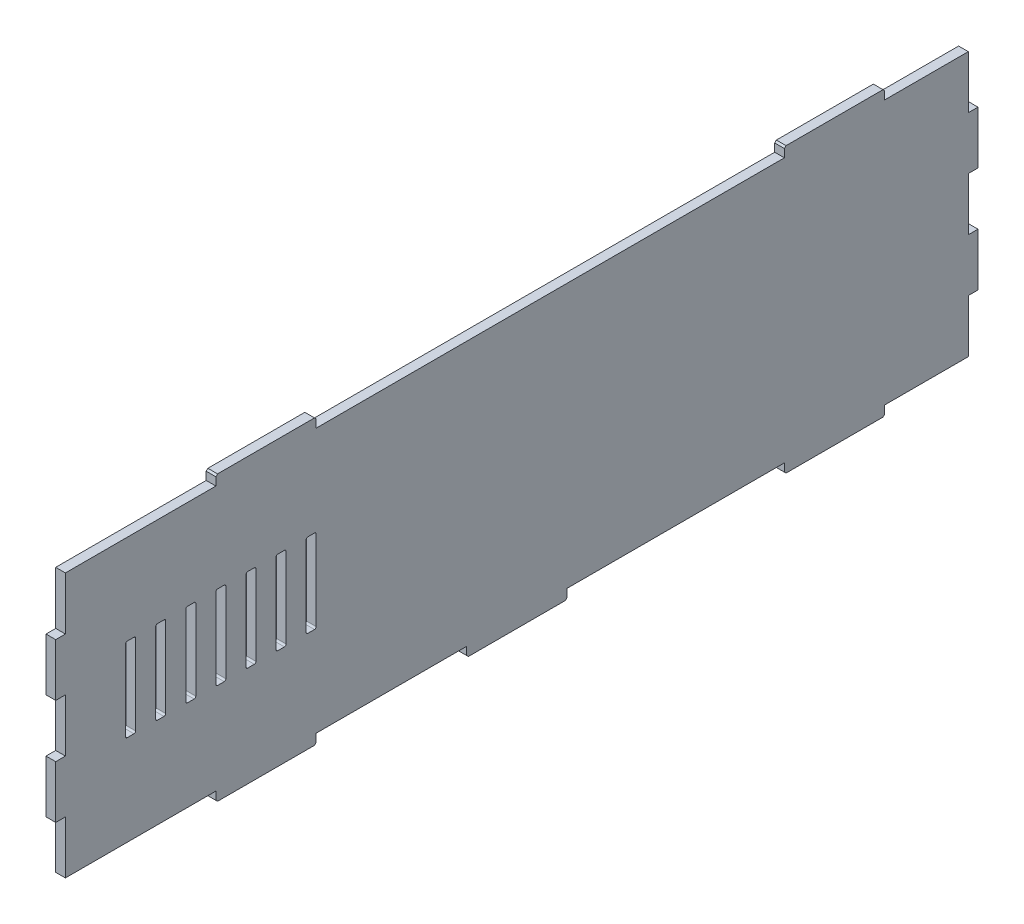
from build123d import *

# Parameters (mm, degrees)
BOSS_EXTRUDE1_DEPTH = 2.9


with BuildPart() as part:
    # Sketch1 → Boss-Extrude1 (new body)
    with BuildSketch(Plane(origin=(-118.9, 0, 0), x_dir=(0, 0, -1), z_dir=(1, 0, 0))):
        Polygon((135, 2.9), (110, 2.9), (110, 0.5), (109.5, 0), (80.5, 0), (80, 0.5), (80, 2.9), (15, 2.9), (15, 0.5), (14.5, 0), (-14.5, 0), (-15, 0.5), (-15, 2.9), (-60, 2.9), (-60, 0.5), (-60.5, 0), (-89.5, 0), (-90, 0.5), (-90, 2.9), (-135, 2.9), (-135, 18.725), (-137.9, 18.725), (-137.9, 34.475), (-135, 34.475), (-135, 50.325), (-137.9, 50.325), (-137.9, 66.075), (-135, 66.075), (-135, 81.9), (-90, 81.9), (-90, 84.3), (-89.5, 84.8), (-60.5, 84.8), (-60, 84.3), (-60, 81.9), (80, 81.9), (80, 84.3), (80.5, 84.8), (109.5, 84.8), (110, 84.3), (110, 81.9), (135, 81.9), (135, 66.075), (137.9, 66.075), (137.9, 50.325), (135, 50.325), (135, 34.475), (137.9, 34.475), (137.9, 18.725), (135, 18.725), align=None)
        with BuildLine():
            Line((-114.5, 30), (-116.5, 30))
            ThreePointArc((-116.5, 30), (-116.853553391, 30.146446609), (-117, 30.5))
            Line((-117, 30.5), (-117, 54.5))
            ThreePointArc((-117, 54.5), (-116.853553391, 54.853553391), (-116.5, 55))
            Line((-116.5, 55), (-114.5, 55))
            ThreePointArc((-114.5, 55), (-114.146446609, 54.853553391), (-114, 54.5))
            Line((-114, 54.5), (-114, 30.5))
            ThreePointArc((-114, 30.5), (-114.146446609, 30.146446609), (-114.5, 30))
        make_face(mode=Mode.SUBTRACT)
        with BuildLine():
            Line((-105.5, 30), (-107.5, 30))
            ThreePointArc((-107.5, 30), (-107.853553391, 30.146446609), (-108, 30.5))
            Line((-108, 30.5), (-108, 54.5))
            ThreePointArc((-108, 54.5), (-107.853553391, 54.853553391), (-107.5, 55))
            Line((-107.5, 55), (-105.5, 55))
            ThreePointArc((-105.5, 55), (-105.146446609, 54.853553391), (-105, 54.5))
            Line((-105, 54.5), (-105, 30.5))
            ThreePointArc((-105, 30.5), (-105.146446609, 30.146446609), (-105.5, 30))
        make_face(mode=Mode.SUBTRACT)
        with BuildLine():
            Line((-96.5, 30), (-98.5, 30))
            ThreePointArc((-98.5, 30), (-98.853553391, 30.146446609), (-99, 30.5))
            Line((-99, 30.5), (-99, 54.5))
            ThreePointArc((-99, 54.5), (-98.853553391, 54.853553391), (-98.5, 55))
            Line((-98.5, 55), (-96.5, 55))
            ThreePointArc((-96.5, 55), (-96.146446609, 54.853553391), (-96, 54.5))
            Line((-96, 54.5), (-96, 30.5))
            ThreePointArc((-96, 30.5), (-96.146446609, 30.146446609), (-96.5, 30))
        make_face(mode=Mode.SUBTRACT)
        with BuildLine():
            Line((-87.5, 30), (-89.5, 30))
            ThreePointArc((-89.5, 30), (-89.853553391, 30.146446609), (-90, 30.5))
            Line((-90, 30.5), (-90, 54.5))
            ThreePointArc((-90, 54.5), (-89.853553391, 54.853553391), (-89.5, 55))
            Line((-89.5, 55), (-87.5, 55))
            ThreePointArc((-87.5, 55), (-87.146446609, 54.853553391), (-87, 54.5))
            Line((-87, 54.5), (-87, 30.5))
            ThreePointArc((-87, 30.5), (-87.146446609, 30.146446609), (-87.5, 30))
        make_face(mode=Mode.SUBTRACT)
        with BuildLine():
            Line((-78.5, 30), (-80.5, 30))
            ThreePointArc((-80.5, 30), (-80.853553391, 30.146446609), (-81, 30.5))
            Line((-81, 30.5), (-81, 54.5))
            ThreePointArc((-81, 54.5), (-80.853553391, 54.853553391), (-80.5, 55))
            Line((-80.5, 55), (-78.5, 55))
            ThreePointArc((-78.5, 55), (-78.146446609, 54.853553391), (-78, 54.5))
            Line((-78, 54.5), (-78, 30.5))
            ThreePointArc((-78, 30.5), (-78.146446609, 30.146446609), (-78.5, 30))
        make_face(mode=Mode.SUBTRACT)
        with BuildLine():
            Line((-69.5, 30), (-71.5, 30))
            ThreePointArc((-71.5, 30), (-71.853553391, 30.146446609), (-72, 30.5))
            Line((-72, 30.5), (-72, 54.5))
            ThreePointArc((-72, 54.5), (-71.853553391, 54.853553391), (-71.5, 55))
            Line((-71.5, 55), (-69.5, 55))
            ThreePointArc((-69.5, 55), (-69.146446609, 54.853553391), (-69, 54.5))
            Line((-69, 54.5), (-69, 30.5))
            ThreePointArc((-69, 30.5), (-69.146446609, 30.146446609), (-69.5, 30))
        make_face(mode=Mode.SUBTRACT)
        with BuildLine():
            Line((-60.5, 30), (-62.5, 30))
            ThreePointArc((-62.5, 30), (-62.853553391, 30.146446609), (-63, 30.5))
            Line((-63, 30.5), (-63, 54.5))
            ThreePointArc((-63, 54.5), (-62.853553391, 54.853553391), (-62.5, 55))
            Line((-62.5, 55), (-60.5, 55))
            ThreePointArc((-60.5, 55), (-60.146446609, 54.853553391), (-60, 54.5))
            Line((-60, 54.5), (-60, 30.5))
            ThreePointArc((-60, 30.5), (-60.146446609, 30.146446609), (-60.5, 30))
        make_face(mode=Mode.SUBTRACT)
    extrude(amount=BOSS_EXTRUDE1_DEPTH)


solid = part.part
